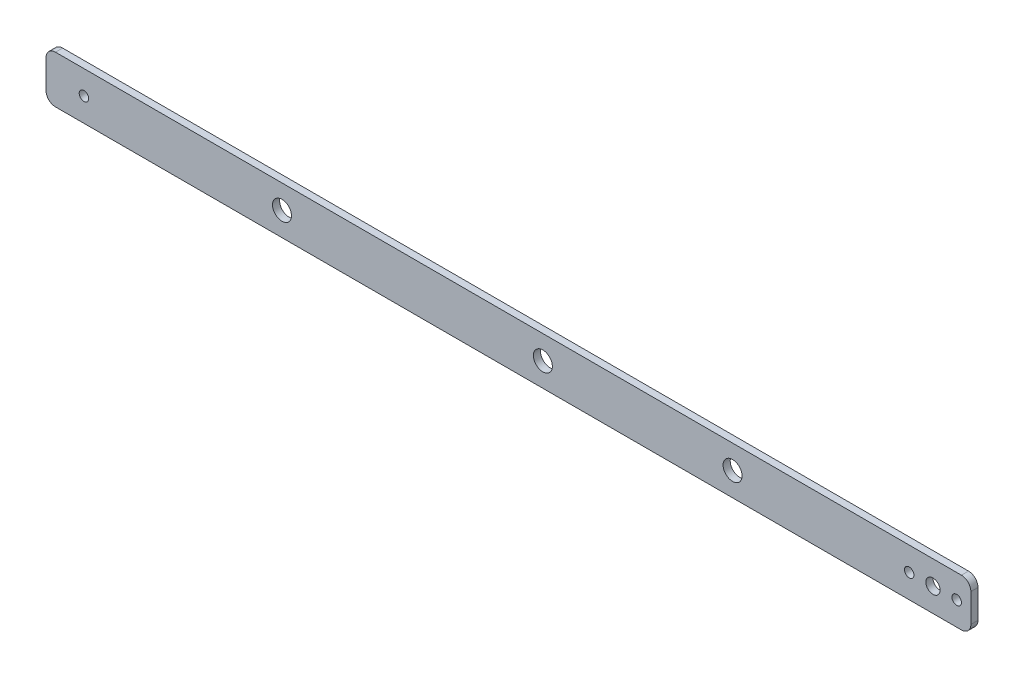
from build123d import *

# Parameters (mm, degrees)
SKETCH_1_W               = 195
SKETCH_1_H               = 10
SKETCH_1_R               = 2
EXTRUDE_1_DEPTH          = 1.5
CUT_EXTRUDE_1_DEPTH      = 12
CUT_EXTRUDE_1_DEPTH_BACK = 15
SKETCH_2_R               = 1
SKETCH_3_R               = 1
SKETCH_3_R_2             = 1.5
CUT_EXTRUDE_2_DEPTH      = 10
FILLET_1_R               = 2


with BuildPart() as part:
    # 草图1 → 凸台-拉伸1 (new body)
    with BuildSketch(Plane.XY):
        with Locations((-102.5, -5)):
            Rectangle(SKETCH_1_W, SKETCH_1_H)
        with Locations((-55.242474917, -5.000000002)):
            Circle(SKETCH_1_R, mode=Mode.SUBTRACT)
        with Locations((-95.242474917, -5.000000002)):
            Circle(SKETCH_1_R, mode=Mode.SUBTRACT)
        with Locations((-150.242474917, -5.000000002)):
            Circle(SKETCH_1_R, mode=Mode.SUBTRACT)
    extrude(amount=EXTRUDE_1_DEPTH)

    # 草图2 → 切除-拉伸1 (cut, two sides: drawn at the far end of the back side and taken through both)
    with BuildSketch(Plane.XY.offset(1.5).offset(-CUT_EXTRUDE_1_DEPTH_BACK)):
        with Locations((-192, -5)):
            Circle(SKETCH_2_R)
    extrude(amount=CUT_EXTRUDE_1_DEPTH + CUT_EXTRUDE_1_DEPTH_BACK, mode=Mode.SUBTRACT)

    # 草图3 → 切除-拉伸2 (cut)
    with BuildSketch(Plane.XY.offset(1.5)):
        with Locations((-8, -5)):
            Circle(SKETCH_3_R)
        with Locations((-13, -5)):
            Circle(SKETCH_3_R_2)
        with Locations((-18, -5)):
            Circle(SKETCH_3_R)
    extrude(amount=-CUT_EXTRUDE_2_DEPTH, mode=Mode.SUBTRACT)

    # 圆角1
    fillet_1_edges = [part.edges().sort_by_distance(p)[0] for p in [
        (-200, 0, 0.75),
        (-5, 0, 0.75),
        (-5, -10, 0.75),
        (-200, -10, 0.75),
    ]]
    fillet(fillet_1_edges, radius=FILLET_1_R)


solid = part.part
